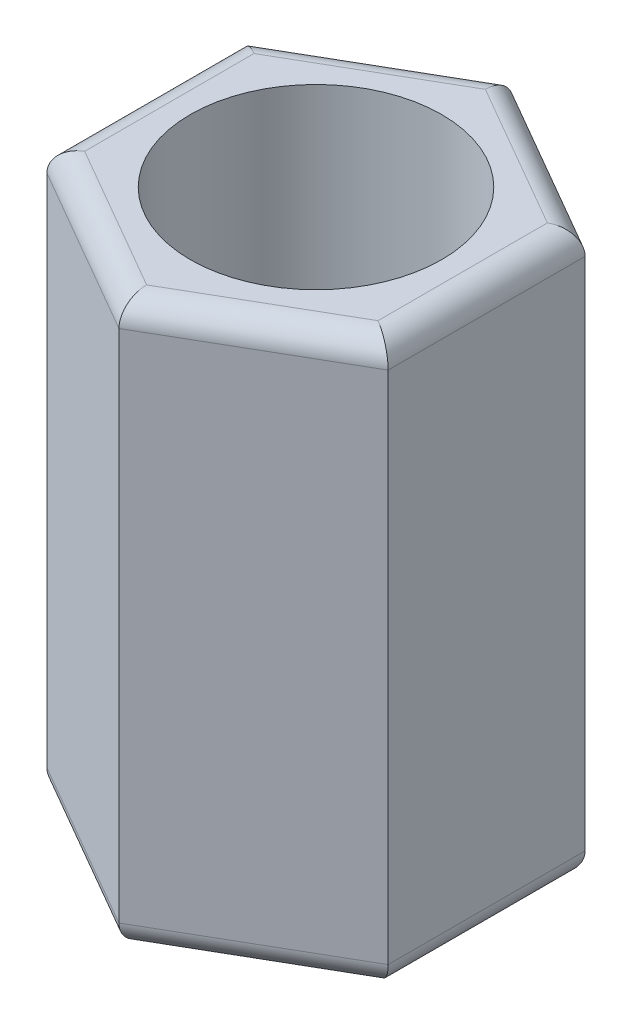
from build123d import *

# Parameters (mm, degrees)
SKETCH1_R           = 1.05
BOSS_EXTRUDE1_DEPTH = 4.7
FILLET1_R           = 0.2


with BuildPart() as part:
    # Sketch1 → Boss-Extrude1 (new body)
    with BuildSketch(Plane(origin=(0, 0, 0), x_dir=(1, 0, 0), z_dir=(0, 1, 0))):
        Polygon((1.425, 0.822724134), (0, 1.645448267), (-1.425, 0.822724134), (-1.425, -0.822724134), (0, -1.645448267), (1.425, -0.822724134), align=None)
        with Locations(Location((0, 0, 0), (0, 0, 270))):
            Circle(SKETCH1_R, mode=Mode.SUBTRACT)
    extrude(amount=BOSS_EXTRUDE1_DEPTH)

    # Fillet1
    fillet1_edges = [part.edges().sort_by_distance(p)[0] for p in [
        (-0.7125, 4.7, -1.2340862),
        (-1.425, 4.7, 0),
        (-0.7125, 4.7, 1.2340862),
        (0.7125, 4.7, 1.2340862),
        (1.425, 4.7, 0),
        (0.7125, 0, 1.2340862),
        (-0.7125, 0, 1.2340862),
        (-1.425, 0, 0),
        (-0.7125, 0, -1.2340862),
        (0.7125, 0, -1.2340862),
        (1.425, 0, 0),
        (0.7125, 4.7, -1.2340862),
    ]]
    fillet(fillet1_edges, radius=FILLET1_R)


solid = part.part
